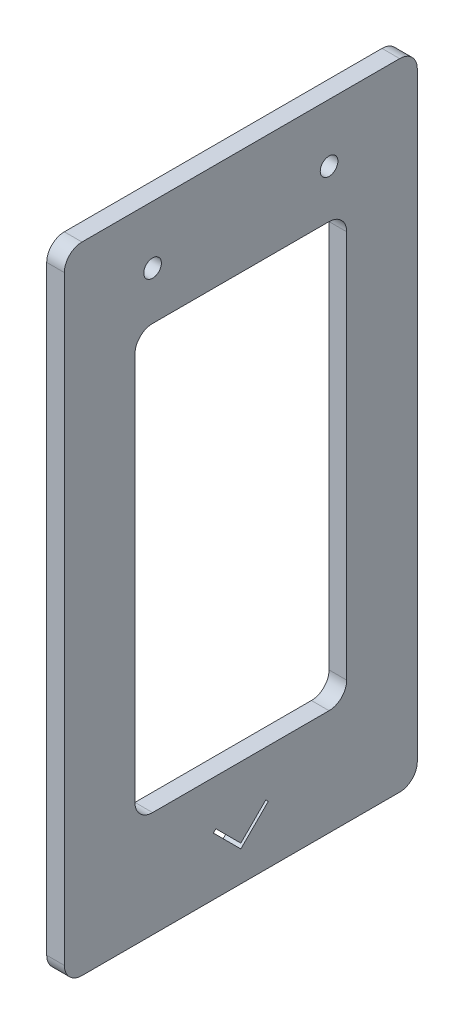
from build123d import *

# Parameters (mm, degrees)
BOSS_EXTRUDE2_DEPTH     = 6.35
CUT_EXTRUDE1_REACH      = 132.909
CUT_EXTRUDE2_DEPTH      = 131.908603613
CUT_EXTRUDE2_DEPTH_BACK = 131.908603613
SKETCH5_R               = 3.175


with BuildPart() as part:
    # Sketch3 → Boss-Extrude2 (new body)
    with BuildSketch(Plane(origin=(0, 0, 0), x_dir=(0, 0, -1), z_dir=(1, 0, 0))):
        with BuildLine():
            Line((-57.15, -114.3), (57.15, -114.3))
            ThreePointArc((57.15, -114.3), (61.640128061, -112.440128061), (63.5, -107.95))
            Line((63.5, -107.95), (63.5, 107.95))
            ThreePointArc((63.5, 107.95), (61.640128061, 112.440128061), (57.15, 114.3))
            Line((57.15, 114.3), (-57.15, 114.3))
            ThreePointArc((-57.15, 114.3), (-61.640128061, 112.440128061), (-63.5, 107.95))
            Line((-63.5, 107.95), (-63.5, -107.95))
            ThreePointArc((-63.5, -107.95), (-61.640128061, -112.440128061), (-57.15, -114.3))
        make_face()
        with BuildLine():
            Line((-31.75, -76.2), (31.75, -76.2))
            ThreePointArc((31.75, -76.2), (36.240128061, -74.340128061), (38.1, -69.85))
            Line((38.1, -69.85), (38.1, 69.85))
            ThreePointArc((38.1, 69.85), (36.240128061, 74.340128061), (31.75, 76.2))
            Line((31.75, 76.2), (-31.75, 76.2))
            ThreePointArc((-31.75, 76.2), (-36.240128061, 74.340128061), (-38.1, 69.85))
            Line((-38.1, 69.85), (-38.1, -69.85))
            ThreePointArc((-38.1, -69.85), (-36.240128061, -74.340128061), (-31.75, -76.2))
        make_face(mode=Mode.SUBTRACT)
    extrude(amount=BOSS_EXTRUDE2_DEPTH)

    # Sketch4 → Cut-Extrude1 (cut, up to next)
    with BuildSketch(Plane(origin=(6.35, 0, 0), x_dir=(0, 0, -1), z_dir=(1, 0, 0)), mode=Mode.PRIVATE) as cut_extrude1_sk1:
        Polygon((0, -101.6), (-8.980256121, -92.619743879), (-9.878281733, -93.517769491), (0, -103.396051224), (9.878281733, -93.517769491), (8.980256121, -92.619743879), align=None)
    cut_extrude1_tool1 = extrude(cut_extrude1_sk1.sketch, amount=-CUT_EXTRUDE1_REACH, mode=Mode.PRIVATE) & part.part
    add(cut_extrude1_tool1.solids().sort_by_distance((6.35, -97.269002, 4.649259))[0], mode=Mode.SUBTRACT)

    # Sketch5 → Cut-Extrude2 (cut, two sides: drawn at the far end of the back side and taken through both)
    with BuildSketch(Plane(origin=(6.35, 0, 0), x_dir=(0, 0, -1), z_dir=(1, 0, 0)).offset(-CUT_EXTRUDE2_DEPTH_BACK)):
        with Locations((-31.75, 93.472)):
            Circle(SKETCH5_R)
        with Locations((31.75, 93.472)):
            Circle(SKETCH5_R)
    extrude(amount=CUT_EXTRUDE2_DEPTH + CUT_EXTRUDE2_DEPTH_BACK, mode=Mode.SUBTRACT)


solid = part.part
